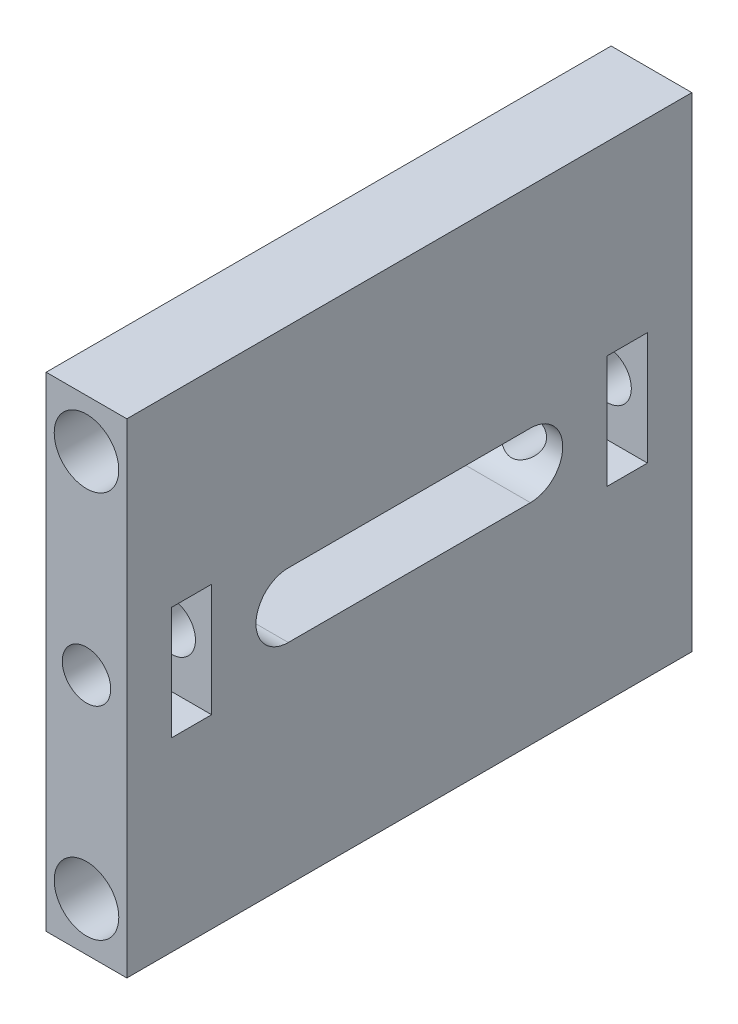
from build123d import *

# Parameters (mm, degrees)
ESQUISSE1_W             = 5
ESQUISSE1_H             = 30
BOSS_EXTRU_1_DEPTH      = 35
ENL_V_MAT_EXTRU_1_DEPTH = 39.405728739
ESQUISSE3_R             = 1.5
ESQUISSE3_R_2           = 2
ENL_V_MAT_EXTRU_2_DEPTH = 40
ESQUISSE4_W             = 2.5
ESQUISSE4_H             = 7
ENL_V_MAT_EXTRU_3_DEPTH = 10


with BuildPart() as part:
    # Esquisse1 → Boss.-Extru.1 (new body)
    with BuildSketch(Plane.XY):
        Rectangle(ESQUISSE1_W, ESQUISSE1_H)
    extrude(amount=BOSS_EXTRU_1_DEPTH)

    # Esquisse2 → Enlèv. mat.-Extru.1 (cut, through all)
    with BuildSketch(Plane(origin=(2.5, 0, 0), x_dir=(0, 0, -1), z_dir=(1, 0, 0))):
        with BuildLine():
            Line((-10, -2), (-25, -2))
            ThreePointArc((-25, -2), (-27, 0), (-25, 2))
            Line((-25, 2), (-10, 2))
            ThreePointArc((-10, 2), (-8, 0), (-10, -2))
        make_face()
    extrude(amount=-ENL_V_MAT_EXTRU_1_DEPTH, mode=Mode.SUBTRACT)

    # Esquisse3 → Enlèv. mat.-Extru.2 (cut)
    with BuildSketch(Plane.XY.offset(35)):
        Circle(ESQUISSE3_R)
        with Locations((0, -12)):
            Circle(ESQUISSE3_R_2)
        with Locations(Location((0, 12, 0), (0, 0, 180))):
            Circle(ESQUISSE3_R_2)
    extrude(amount=-ENL_V_MAT_EXTRU_2_DEPTH, mode=Mode.SUBTRACT)

    # Esquisse4 → Enlèv. mat.-Extru.3 (cut)
    with BuildSketch(Plane(origin=(2.5, 0, 0), x_dir=(0, 0, -1), z_dir=(1, 0, 0))):
        with Locations((-31, 0)):
            Rectangle(ESQUISSE4_W, ESQUISSE4_H)
    enl_v_mat_extru_3 = extrude(amount=-ENL_V_MAT_EXTRU_3_DEPTH, mode=Mode.SUBTRACT)

    # Symétrie1: Enlèv. mat.-Extru.3 across plane
    add(enl_v_mat_extru_3.mirror(Plane.XY.offset(17.5)), mode=Mode.SUBTRACT)


solid = part.part
